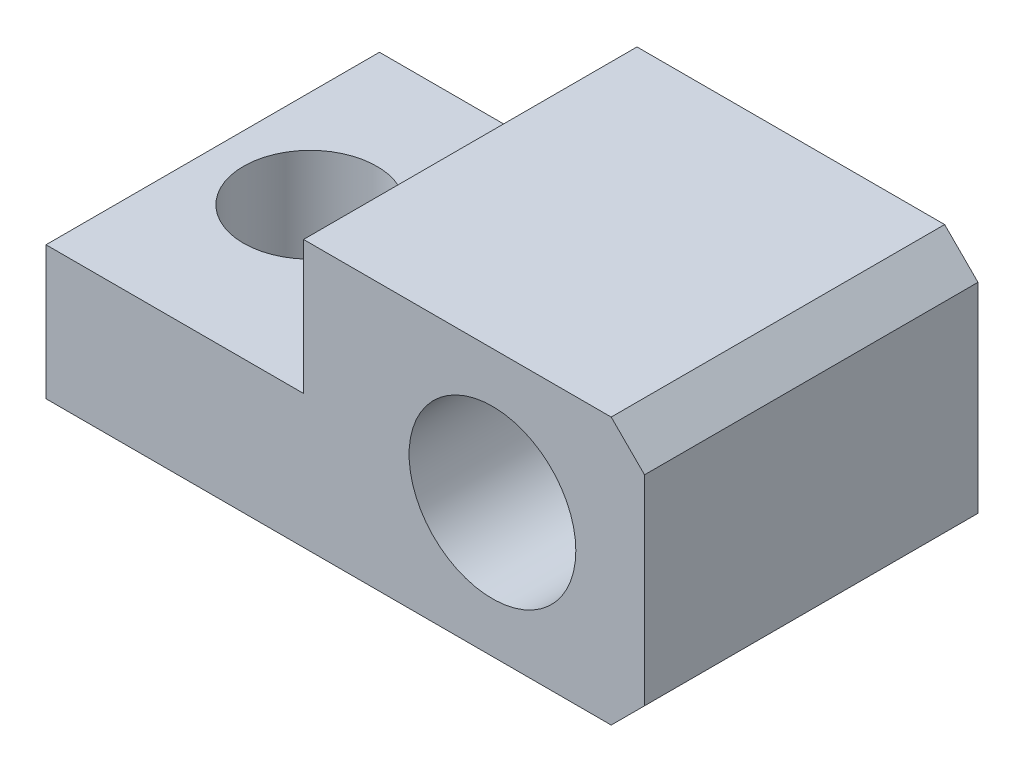
from build123d import *

# Parameters (mm, degrees)
SKETCH_1_R          = 2.5
EXTRUDE_1_DEPTH     = 10
SKETCH_2_R          = 2
CUT_EXTRUDE_2_DEPTH = 18.18324903


with BuildPart() as part:
    # Эскиз1 → Вытянуть1 (new body)
    with BuildSketch(Plane.XY):
        Polygon((3.560836522, 4), (4.560836522, 3), (4.560836522, -3), (3.560836522, -4), (-13.388952432, -4), (-13.388952432, 0), (-5.665361164, 0), (-5.665361164, 4), align=None)
        Circle(SKETCH_1_R, mode=Mode.SUBTRACT)
    extrude(amount=EXTRUDE_1_DEPTH)

    # Эскиз2 → Вытянуть2 (cut, through all)
    with BuildSketch(Plane(origin=(0, 0, 0), x_dir=(-1, 0, 0), z_dir=(0, 1, 0))):
        with Locations(Location((10.466786093, 5, 0), (0, 0, 90))):
            Circle(SKETCH_2_R)
    extrude(amount=-CUT_EXTRUDE_2_DEPTH, mode=Mode.SUBTRACT)


solid = part.part
